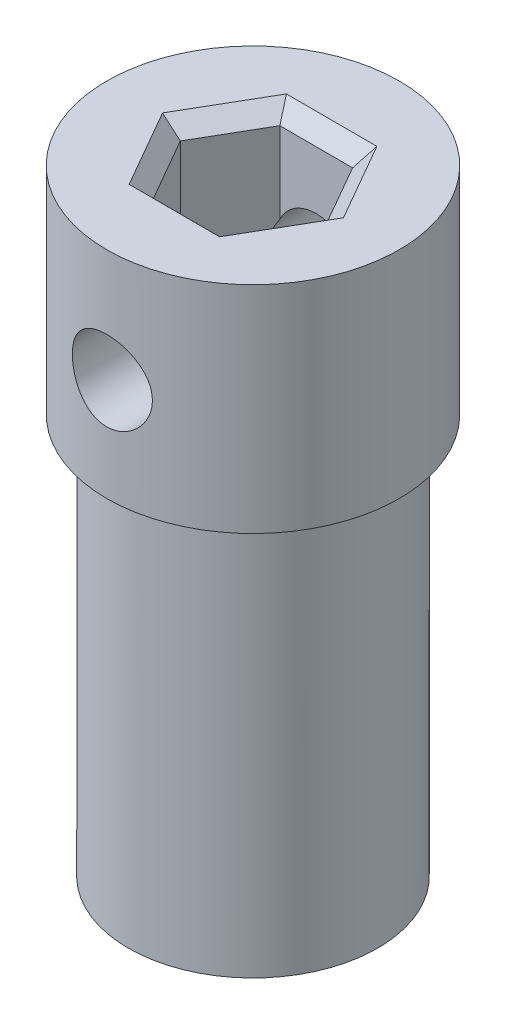
from build123d import *

# Parameters (mm, degrees)
SKETCH1_R           = 4.05
BOSS_EXTRUDE1_DEPTH = 20
BOSS_EXTRUDE2_DEPTH = 5
SKETCH3_R           = 4.75
SKETCH3_R_2         = 4.05
BOSS_EXTRUDE3_DEPTH = 7
CHAMFER1_SIZE       = 0.5
SKETCH4_R           = 1.3
CUT_EXTRUDE1_DEPTH  = 23.645363764


with BuildPart() as part:
    # Sketch1 → Boss-Extrude1 (new body)
    with BuildSketch(Plane(origin=(0, 0, 0), x_dir=(1, 0, 0), z_dir=(0, 1, 0))):
        with Locations(Location((0, 0, 0), (0, 0, 270))):
            Circle(SKETCH1_R)
        Polygon((1.187868906, 2.047510878), (-1.179261982, 2.052480088), (-2.367130888, 0.00496921), (-1.187868906, -2.047510878), (1.179261982, -2.052480088), (2.367130888, -0.00496921), align=None, mode=Mode.SUBTRACT)
    extrude(amount=BOSS_EXTRUDE1_DEPTH)

    # Sketch2 → Boss-Extrude2 (add)
    with BuildSketch(Plane.XZ):
        Polygon((1.187868906, -2.047510878), (2.367130888, 0.00496921), (1.179261982, 2.052480088), (-1.187868906, 2.047510878), (-2.367130888, -0.00496921), (-1.179261982, -2.052480088), align=None)
    extrude(amount=-BOSS_EXTRUDE2_DEPTH)

    # Sketch3 → Boss-Extrude3 (add)
    with BuildSketch(Plane(origin=(0, 13, 0), x_dir=(-1, 0, 0), z_dir=(0, -1, 0))):
        with Locations(Location((0, 0, 0), (0, 0, 90))):
            Circle(SKETCH3_R)
        with Locations(Location((0, 0, 0), (0, 0, 90))):
            Circle(SKETCH3_R_2, mode=Mode.SUBTRACT)
    extrude(amount=-BOSS_EXTRUDE3_DEPTH)

    # Chamfer1
    chamfer1_edges = [part.edges().sort_by_distance(p)[0] for p in [
        (1.777499897, 20, -1.021270834),
        (0.004303462, 20, -2.049995483),
        (-1.773196435, 20, -1.028724649),
        (-1.777499897, 20, 1.021270834),
        (-0.004303462, 20, 2.049995483),
        (1.773196435, 20, 1.028724649),
    ]]
    chamfer(chamfer1_edges, length=CHAMFER1_SIZE)

    # Sketch4 → Cut-Extrude1 (cut, through all)
    with BuildSketch(Plane(origin=(0, 0, -4.75), x_dir=(-1, 0, 0), z_dir=(0, 0, -1))):
        with Locations(Location((0, 16.319152566, 0), (0, 0, 23.97183149))):
            Circle(SKETCH4_R)
    extrude(amount=-CUT_EXTRUDE1_DEPTH, mode=Mode.SUBTRACT)


solid = part.part
